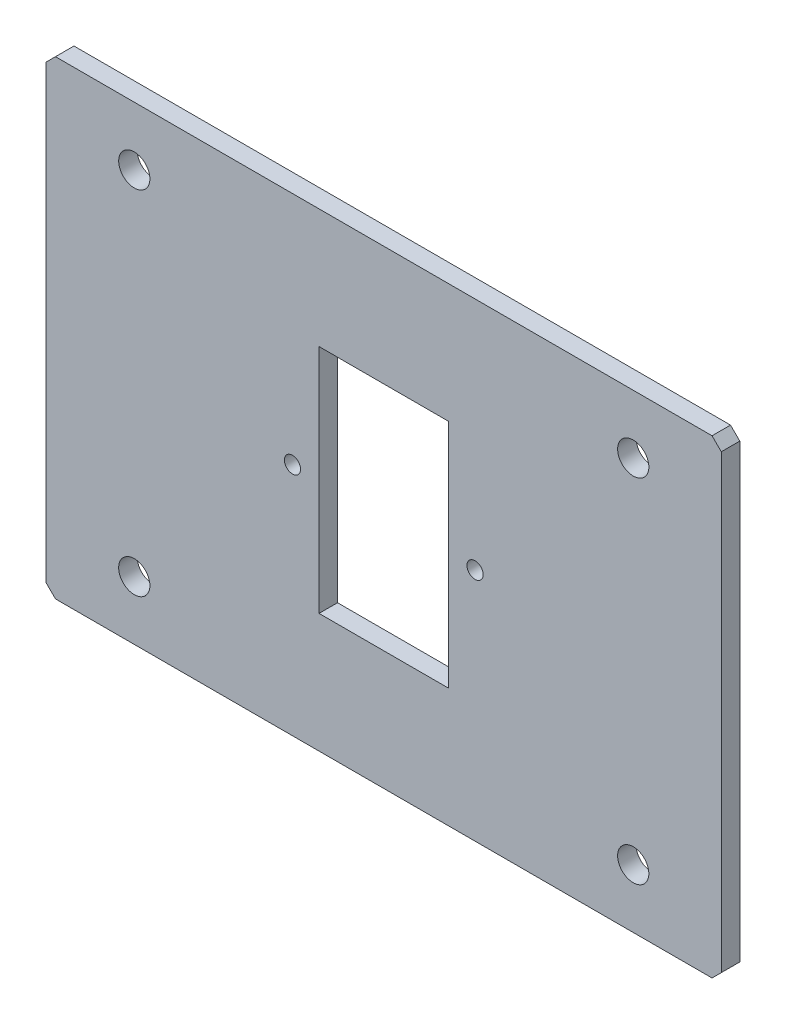
from build123d import *

# Parameters (mm, degrees)
SKETCH1_W                   = 146.05
SKETCH1_H                   = 101.6
SKETCH1_R                   = 1.75
SKETCH1_W_2                 = 28
SKETCH1_H_2                 = 50
BOSS_EXTRUDE1_DEPTH         = 4
F_1_4_CLEARANCE_HOLE1_D     = 6.7564
F_1_4_CLEARANCE_HOLE1_DEPTH = 12
F_1_4_CLEARANCE_HOLE1_TIP   = 2.029827343
CHAMFER1_SIZE               = 2


with BuildPart() as part:
    # Sketch1 → Boss-Extrude1 (new body)
    with BuildSketch(Plane.XY):
        Rectangle(SKETCH1_W, SKETCH1_H)
        with Locations((-19.75, 0)):
            Circle(SKETCH1_R, mode=Mode.SUBTRACT)
        with Locations((19.75, 0)):
            Circle(SKETCH1_R, mode=Mode.SUBTRACT)
        Rectangle(SKETCH1_W_2, SKETCH1_H_2, mode=Mode.SUBTRACT)
    extrude(amount=BOSS_EXTRUDE1_DEPTH)

    # 1/4 Clearance Hole1
    with Locations(Plane.XY.offset(4)):
        with Locations((-53.975, 38.1), (53.975, 38.1), (53.975, -38.1), (-53.975, -38.1)):
            Hole(F_1_4_CLEARANCE_HOLE1_D / 2, depth=F_1_4_CLEARANCE_HOLE1_DEPTH)
            with Locations((0, 0, -(F_1_4_CLEARANCE_HOLE1_DEPTH + F_1_4_CLEARANCE_HOLE1_TIP / 2))):  # 118° drill point
                Cone(0, F_1_4_CLEARANCE_HOLE1_D / 2, F_1_4_CLEARANCE_HOLE1_TIP, mode=Mode.SUBTRACT)

    # Chamfer1
    chamfer1_edges = [part.edges().sort_by_distance(p)[0] for p in [
        (-73.025, -50.8, 2),
        (-73.025, 50.8, 2),
        (73.025, 50.8, 2),
        (73.025, -50.8, 2),
    ]]
    chamfer(chamfer1_edges, length=CHAMFER1_SIZE)


solid = part.part
